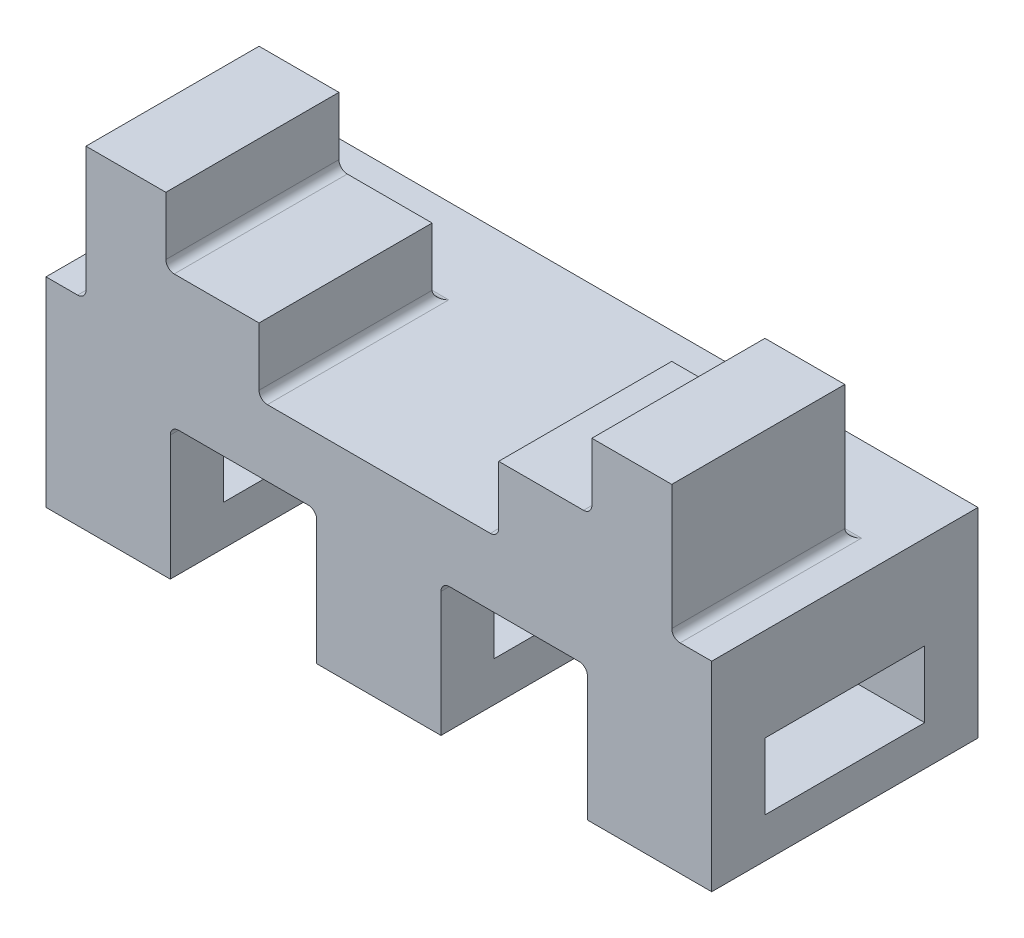
from build123d import *

# Parameters (mm, degrees)
BOSS_EXTRUDE1_DEPTH = 50.8
BOSS_EXTRUDE2_DEPTH = 33.02
FILLET2_R           = 1.5875
CUT_EXTRUDE1_REACH  = 152.804
SKETCH3_W           = 30.48
SKETCH3_H           = 12.7


with BuildPart() as part:
    # Sketch1 → Boss-Extrude1 (new body)
    with BuildSketch(Plane.XY):
        Polygon((-63.5, 0), (-63.5, 38.1), (63.5, 38.1), (63.5, 0), (39.793333333, 0), (39.793333333, 25.4), (11.853333333, 25.4), (11.853333333, 0), (-11.853333333, 0), (-11.853333333, 25.4), (-39.793333333, 25.4), (-39.793333333, 0), align=None)
    extrude(amount=BOSS_EXTRUDE1_DEPTH)

    # Sketch2 → Boss-Extrude2 (add)
    with BuildSketch(Plane.XY.offset(50.8)):
        Polygon((55.876679783, 38.1), (55.876679783, 63.5), (40.636679783, 63.5), (40.636679783, 50.8), (22.856679783, 50.8), (22.856679783, 38.1), align=None)
    boss_extrude2 = extrude(amount=-BOSS_EXTRUDE2_DEPTH)

    # Mirror1: Boss-Extrude2 across plane
    add(boss_extrude2.mirror(Plane(origin=(0, 0, 0), x_dir=(0, 0, 1), z_dir=(1, 0, 0))))

    # Fillet2
    fillet2_edges = [part.edges().sort_by_distance(p)[0] for p in [
        (39.793333333, 25.4, 25.4),
        (11.853333333, 25.4, 25.4),
        (-11.853333333, 25.4, 25.4),
        (-39.793333333, 25.4, 25.4),
        (39.366679783, 38.1, 17.78),
        (55.876679783, 38.1, 34.29),
        (22.856679783, 38.1, 34.29),
        (40.636679783, 50.8, 34.29),
        (-22.856679783, 38.1, 34.29),
        (-55.876679783, 38.1, 34.29),
        (-40.636679783, 50.8, 34.29),
        (-39.366679783, 38.1, 17.78),
    ]]
    fillet(fillet2_edges, radius=FILLET2_R)

    # Cut-Extrude1: up to this face of the body (flat: up to its plane)
    cut_extrude1_end = Plane(part.part.faces().sort_by_distance((63.5, 19.05, 25.4))[0])
    # Sketch3 → Cut-Extrude1 (cut, up to the picked face)
    with BuildSketch(Plane.ZY.offset(63.5), mode=Mode.PRIVATE) as cut_extrude1_sk1:
        with Locations((25.4, 13.97)):
            Rectangle(SKETCH3_W, SKETCH3_H)
    cut_extrude1_tool1 = split(extrude(cut_extrude1_sk1.sketch, amount=-CUT_EXTRUDE1_REACH, mode=Mode.PRIVATE), bisect_by=cut_extrude1_end, keep=Keep.BOTH, mode=Mode.PRIVATE)
    add(cut_extrude1_tool1.solids().sort_by(Axis((-63.5, 13.97, 25.4), (1, 0, 0)))[0], mode=Mode.SUBTRACT)


solid = part.part
